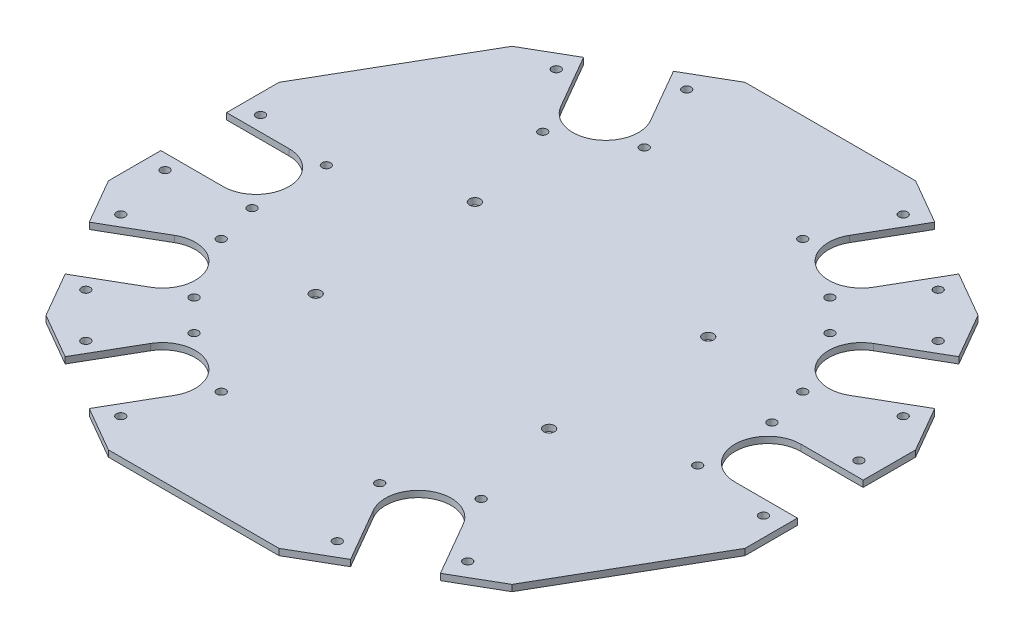
from build123d import *

# Parameters (mm, degrees)
BOSS_EXTRUDE1_DEPTH = 3
SKETCH2_R           = 2.05
HEXCUT1_DEPTH       = 3
SKETCH6_R           = 2.05
QUADCUT1_DEPTH      = 3
CUT_EXTRUDE3_DEPTH  = 3
CUT_EXTRUDE4_DEPTH  = 3
SKETCH10_R          = 2.55
CUT_EXTRUDE6_DEPTH  = 3


with BuildPart() as part:
    # Sketch1 → Boss-Extrude1 (new body)
    with BuildSketch(Plane(origin=(0, 0, 0), x_dir=(1, 0, 0), z_dir=(0, 1, 0))):
        Polygon((150, -40.192378865), (150, 40.192378865), (109.807621135, 109.807621135), (40.192378865, 150), (-40.192378865, 150), (-109.807621135, 109.807621135), (-150, 40.192378865), (-150, -40.192378865), (-109.807621135, -109.807621135), (-40.192378865, -150), (40.192378865, -150), (109.807621135, -109.807621135), align=None)
    extrude(amount=BOSS_EXTRUDE1_DEPTH)

    # Sketch2 → HexCut1 (cut)
    with BuildSketch(Plane(origin=(0, 3, 0), x_dir=(1, 0, 0), z_dir=(0, 1, 0))):
        with Locations(Location((51.014428415, 133.359581934, 0), (0, 0, 270))):
            Circle(SKETCH2_R)
        with Locations(Location((37.344555434, 99.682667397, 0), (0, 0, 270))):
            Circle(SKETCH2_R)
        with Locations(Location((37.344555434, -99.682667397, 0), (0, 0, 270))):
            Circle(SKETCH2_R)
        with Locations(Location((51.014428415, -133.359581934, 0), (0, 0, 270))):
            Circle(SKETCH2_R)
        with Locations(Location((105, 17.5, 0), (0, 0, 270))):
            Circle(SKETCH2_R)
        with Locations(Location((141, 22.5, 0), (0, 0, 270))):
            Circle(SKETCH2_R)
        with Locations(Location((105, -17.5, 0), (0, 0, 270))):
            Circle(SKETCH2_R)
        with Locations(Location((141, -22.5, 0), (0, 0, 270))):
            Circle(SKETCH2_R)
        with Locations(Location((89.985571585, -110.859581934, 0), (0, 0, 270))):
            Circle(SKETCH2_R)
        with Locations(Location((67.655444566, -82.182667397, 0), (0, 0, 270))):
            Circle(SKETCH2_R)
        with Locations(Location((89.985571585, 110.859581934, 0), (0, 0, 270))):
            Circle(SKETCH2_R)
        with Locations(Location((67.655444566, 82.182667397, 0), (0, 0, 270))):
            Circle(SKETCH2_R)
    hexcut1 = extrude(amount=-HEXCUT1_DEPTH, mode=Mode.SUBTRACT)

    # HexCut2: HexCut1 across plane
    add(hexcut1.mirror(Plane(origin=(0, 0, 0), x_dir=(0, 0, 1), z_dir=(1, 0, 0))), mode=Mode.SUBTRACT)

    # Sketch6 → QuadCut1 (cut)
    with BuildSketch(Plane(origin=(0, 3, 0), x_dir=(1, 0, 0), z_dir=(0, 1, 0))):
        with Locations(Location((99.682667397, 37.344555434, 0), (0, 0, 270))):
            Circle(SKETCH6_R)
        with Locations(Location((133.359581934, 51.014428415, 0), (0, 0, 270))):
            Circle(SKETCH6_R)
        with Locations(Location((110.859581934, 89.985571585, 0), (0, 0, 270))):
            Circle(SKETCH6_R)
        with Locations(Location((82.182667397, 67.655444566, 0), (0, 0, 270))):
            Circle(SKETCH6_R)
    quadcut1 = extrude(amount=-QUADCUT1_DEPTH, mode=Mode.SUBTRACT)

    # Mirror1: QuadCut1 across plane
    add(quadcut1.mirror(Plane(origin=(0, 0, 0), x_dir=(0.5000000000000011, 0, 0.8660254037844378), z_dir=(0.8660254037844379, 0, -0.5000000000000012))), mode=Mode.SUBTRACT)

    # Sketch7 → Cut-Extrude3 (cut)
    with BuildSketch(Plane(origin=(0, 3, 0), x_dir=(1, 0, 0), z_dir=(0, 1, 0))):
        with BuildLine():
            Line((46.876606241, 112.192663696), (84.376606241, 177.14456898))
            Line((84.376606241, 177.14456898), (111.223393759, 161.64456898))
            Line((111.223393759, 161.64456898), (73.723393759, 96.692663696))
            ThreePointArc((73.723393759, 96.692663696), (52.55, 91.019269938), (46.876606241, 112.192663696))
        make_face()
        with BuildLine():
            Line((46.876606241, -112.192663696), (84.376606241, -177.14456898))
            Line((84.376606241, -177.14456898), (111.223393759, -161.64456898))
            Line((111.223393759, -161.64456898), (73.723393759, -96.692663696))
            ThreePointArc((73.723393759, -96.692663696), (52.55, -91.019269938), (46.876606241, -112.192663696))
        make_face()
        with BuildLine():
            Line((120.6, 15.5), (160.6, 15.5))
            Line((160.6, 15.5), (160.6, -15.5))
            Line((160.6, -15.5), (120.6, -15.5))
            ThreePointArc((120.6, -15.5), (105.1, 0), (120.6, 15.5))
        make_face()
    cut_extrude3 = extrude(amount=-CUT_EXTRUDE3_DEPTH, mode=Mode.SUBTRACT)

    # Mirror2: Cut-Extrude3 across plane
    add(cut_extrude3.mirror(Plane(origin=(0, 0, 0), x_dir=(0, 0, 1), z_dir=(1, 0, 0))), mode=Mode.SUBTRACT)

    # Sketch8 → Cut-Extrude4 (cut)
    with BuildSketch(Plane(origin=(0, 3, 0), x_dir=(1, 0, 0), z_dir=(0, 1, 0))):
        with BuildLine():
            Line((96.692663696, 73.723393759), (131.333679848, 93.723393759))
            Line((131.333679848, 93.723393759), (146.833679848, 66.876606241))
            Line((146.833679848, 66.876606241), (112.192663696, 46.876606241))
            ThreePointArc((112.192663696, 46.876606241), (91.019269938, 52.55), (96.692663696, 73.723393759))
        make_face()
    cut_extrude4 = extrude(amount=-CUT_EXTRUDE4_DEPTH, mode=Mode.SUBTRACT)

    # Mirror3: Cut-Extrude4 across plane
    add(cut_extrude4.mirror(Plane(origin=(0, 0, 0), x_dir=(0.5000000000000011, 0, 0.8660254037844378), z_dir=(0.8660254037844379, 0, -0.5000000000000012))), mode=Mode.SUBTRACT)

    # Sketch10 → Cut-Extrude6 (cut)
    with BuildSketch(Plane(origin=(0, 3, 0), x_dir=(1, 0, 0), z_dir=(0, 1, 0))):
        with Locations(Location((55, 37.5, 0), (0, 0, 270))):
            Circle(SKETCH10_R)
        with Locations(Location((55, -37.5, 0), (0, 0, 270))):
            Circle(SKETCH10_R)
        with Locations(Location((-55, 37.5, 0), (0, 0, 270))):
            Circle(SKETCH10_R)
        with Locations(Location((-55, -37.5, 0), (0, 0, 270))):
            Circle(SKETCH10_R)
    extrude(amount=-CUT_EXTRUDE6_DEPTH, mode=Mode.SUBTRACT)


solid = part.part
